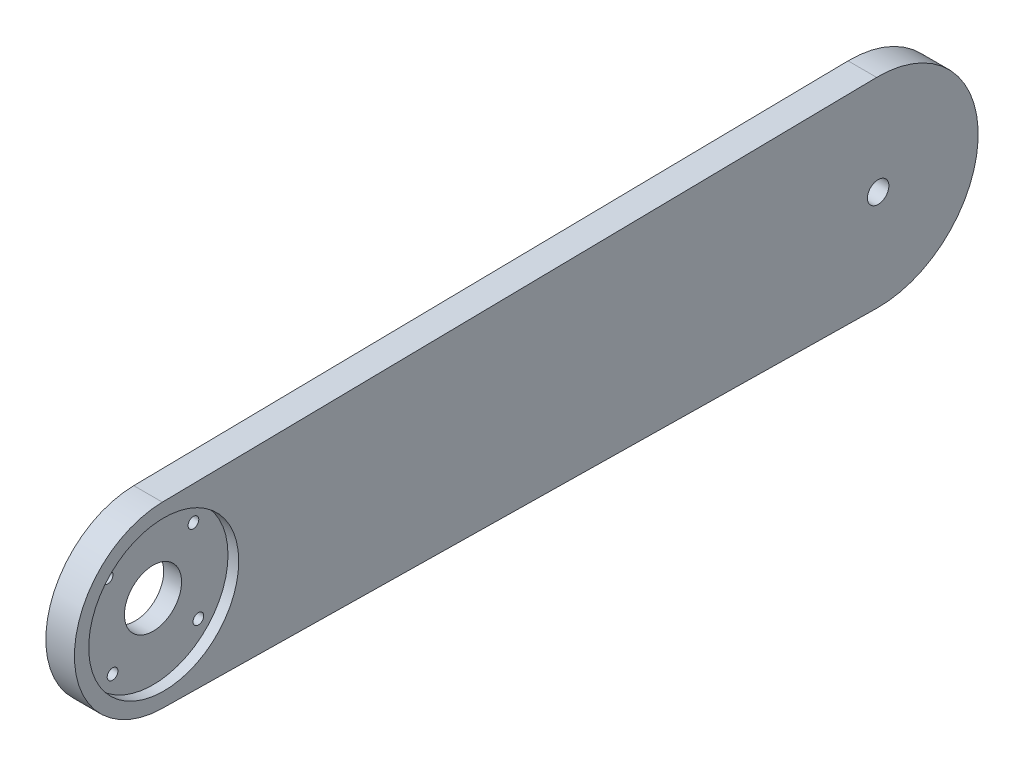
from build123d import *

# Parameters (mm, degrees)
CROQUIS1_R              = 1.5
CROQUIS1_R_2            = 4
SALIENTE_EXTRUIR1_DEPTH = 4
CROQUIS2_R              = 10.5
CORTAR_EXTRUIR1_DEPTH   = 1.5
CROQUIS3_R              = 0.75
CORTAR_EXTRUIR2_DEPTH   = 10


with BuildPart() as part:
    # Croquis1 → Saliente-Extruir1 (new body)
    with BuildSketch(Plane(origin=(0, 0, 0), x_dir=(0, 0, -1), z_dir=(1, 0, 0))):
        with BuildLine():
            Line((-70.1875, 12.498593671), (29.79, 13.998424911))
            ThreePointArc((29.79, 13.998424911), (44, 0), (29.79, -13.998424911))
            Line((29.79, -13.998424911), (-70.1875, -12.498593671))
            ThreePointArc((-70.1875, -12.498593671), (-82.5, 0), (-70.1875, 12.498593671))
        make_face()
        with Locations((30, 0)):
            Circle(CROQUIS1_R, mode=Mode.SUBTRACT)
        with Locations((-70, 0)):
            Circle(CROQUIS1_R_2, mode=Mode.SUBTRACT)
    extrude(amount=SALIENTE_EXTRUIR1_DEPTH)

    # Croquis2 → Cortar-Extruir1 (cut)
    with BuildSketch(Plane(origin=(4, 0, 0), x_dir=(0, 0, -1), z_dir=(1, 0, 0))):
        with Locations((-70, 0)):
            Circle(CROQUIS2_R)
    extrude(amount=-CORTAR_EXTRUIR1_DEPTH, mode=Mode.SUBTRACT)

    # Croquis3 → Cortar-Extruir2 (cut)
    with BuildSketch(Plane.ZY):
        with Locations((63.65189161, -5.658093307)):
            Circle(CROQUIS3_R)
        with Locations((76.34810839, 5.658093307)):
            Circle(CROQUIS3_R)
        with Locations((64.341906693, 6.34810839)):
            Circle(CROQUIS3_R)
        with Locations((75.658093307, -6.34810839)):
            Circle(CROQUIS3_R)
    extrude(amount=-CORTAR_EXTRUIR2_DEPTH, mode=Mode.SUBTRACT)


solid = part.part
